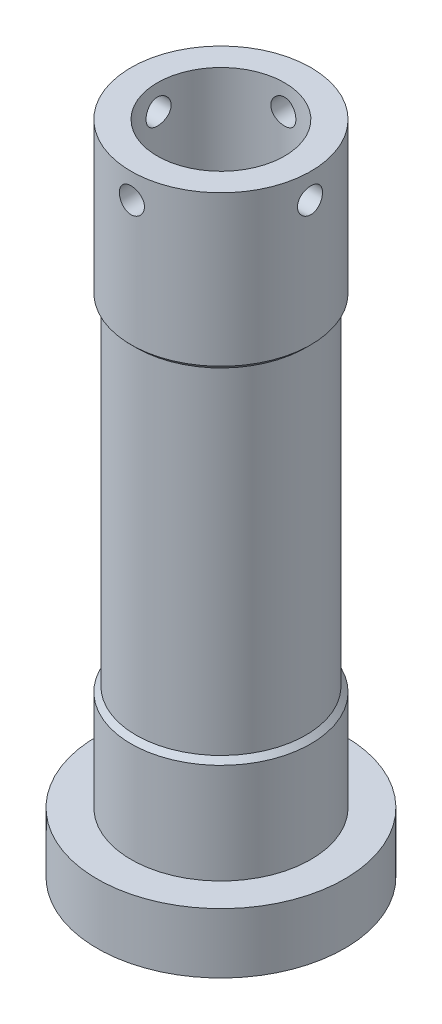
from build123d import *

# Parameters (mm, degrees)
SKETCH_6_W               = 1.25
SKETCH_6_H               = 12.35
PATTERN_CIRCULAR_1_COUNT = 4


with BuildPart() as part:
    # 草图1 → 旋转1 (revolve)
    with BuildSketch(Plane.XY, mode=Mode.PRIVATE) as revolve_1_sk:
        Polygon((6.35, 65.5), (6.35, 0), (12.35, 0), (12.35, 6), (8.975, 6), (8.975, 16), (8.475, 16.5), (8.475, 50), (8.975, 50.5), (8.975, 65.5), align=None)
    revolve(revolve_1_sk.sketch.rotate(Axis((0, 0, 0), (0, 1, 0)), 90), axis=Axis((0, 0, 0), (0, 1, 0)))

    # 草图6 → M3 螺纹孔1 (revolve, cut)
    with BuildSketch(Plane.ZX.offset(63)):
        with Locations((0.625, 6.175)):
            Rectangle(SKETCH_6_W, SKETCH_6_H)
    hole_wizard_m3_1 = revolve(axis=Axis((-6.35, 63, 0), (1, 0, 0)), mode=Mode.SUBTRACT)

    # 阵列(圆周)1: M3 螺纹孔1 ×4 about axis
    pattern_circular_1_axis = Axis((0, 65.5, 0), (0, -1, 0))
    for i in range(1, PATTERN_CIRCULAR_1_COUNT):
        add(hole_wizard_m3_1.rotate(pattern_circular_1_axis, i * 360 / PATTERN_CIRCULAR_1_COUNT), mode=Mode.SUBTRACT)


solid = part.part
